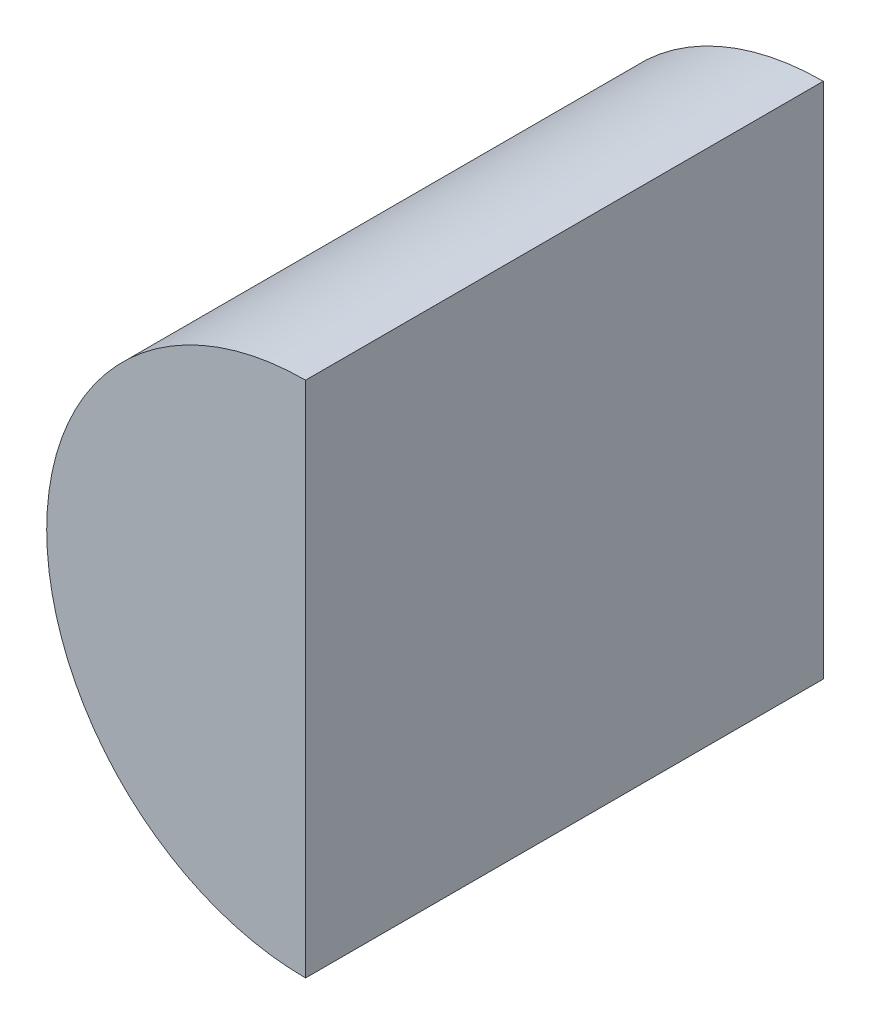
from build123d import *

# Parameters (mm, degrees)
SALIENTE_EXTRUIR1_DEPTH = 50
CROQUIS3_R              = 5
CORTAR_EXTRUIR1_DEPTH   = 10


with BuildPart() as part:
    # Croquis2 → Saliente-Extruir1 (new body)
    with BuildSketch(Plane.XY):
        with BuildLine():
            Line((0, 25), (0, -25))
            ThreePointArc((0, -25), (-25, 0), (0, 25))
        make_face()
    extrude(amount=SALIENTE_EXTRUIR1_DEPTH)

    # Croquis3 → Cortar-Extruir1 (cut)
    with BuildSketch(Plane(origin=(0, 0, 0), x_dir=(-1, 0, 0), z_dir=(0, 0, -1))):
        with Locations((10.746576251, 0)):
            Circle(CROQUIS3_R)
    extrude(amount=-CORTAR_EXTRUIR1_DEPTH, mode=Mode.SUBTRACT)


solid = part.part
